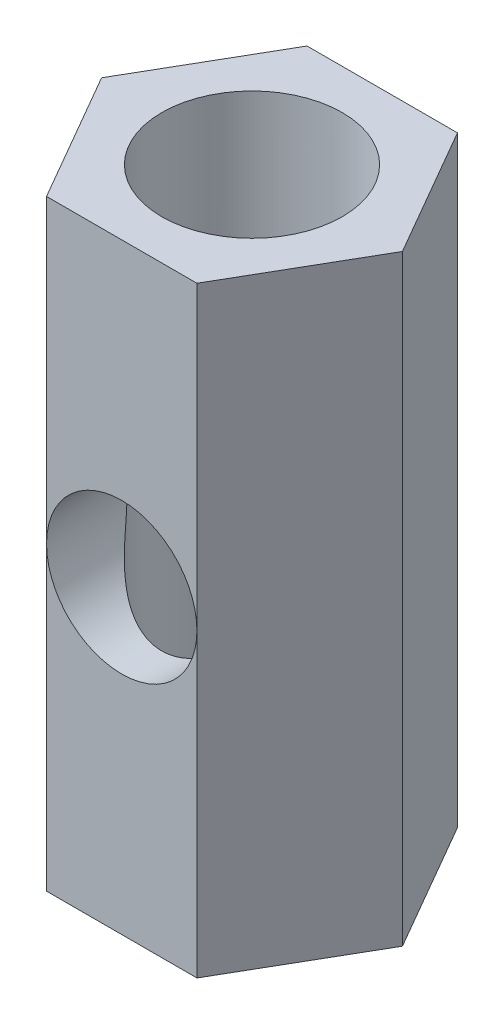
from build123d import *

# Parameters (mm, degrees)
EXTRUDE_1_DEPTH          = 10
SKETCH_2_R               = 1.5
EXTRUDE_2_DEPTH          = 5
SKETCH_3_R               = 1.5
CUT_EXTRUDE_1_DEPTH      = 16.360257159
CUT_EXTRUDE_2_DEPTH      = 11.532687216
CUT_EXTRUDE_2_DEPTH_BACK = 11.532687216
SKETCH_4_R               = 1.25


with BuildPart() as part:
    # Эскиз1 → Бобышка-Вытянуть1 (new body)
    with BuildSketch(Plane(origin=(0, 0, 0), x_dir=(1, 0, 0), z_dir=(0, 1, 0))):
        Polygon((1.25, -2.165063509), (2.5, 0), (1.25, 2.165063509), (-1.25, 2.165063509), (-2.5, 0), (-1.25, -2.165063509), align=None)
    extrude(amount=EXTRUDE_1_DEPTH)

    # Эскиз2 → Бобышка-Вытянуть2 (add)
    with BuildSketch(Plane(origin=(0, 10, 0), x_dir=(1, 0, 0), z_dir=(0, 1, 0))):
        with Locations(Location((0, 0, 0), (0, 0, 270))):
            Circle(SKETCH_2_R)
    extrude(amount=EXTRUDE_2_DEPTH)

    # Эскиз3 → Вырез-Вытянуть1 (cut, through all)
    with BuildSketch(Plane.XZ):
        with Locations(Location((0, 0, 0), (0, 0, 270))):
            Circle(SKETCH_3_R)
    extrude(amount=-CUT_EXTRUDE_1_DEPTH, mode=Mode.SUBTRACT)

    # Эскиз4 → Вырез-Вытянуть2 (cut, two sides: drawn at the far end of the back side and taken through both)
    with BuildSketch(Plane.XY.offset(-CUT_EXTRUDE_2_DEPTH_BACK)):
        with Locations((0, 5)):
            Circle(SKETCH_4_R)
    extrude(amount=CUT_EXTRUDE_2_DEPTH + CUT_EXTRUDE_2_DEPTH_BACK, mode=Mode.SUBTRACT)


solid = part.part
